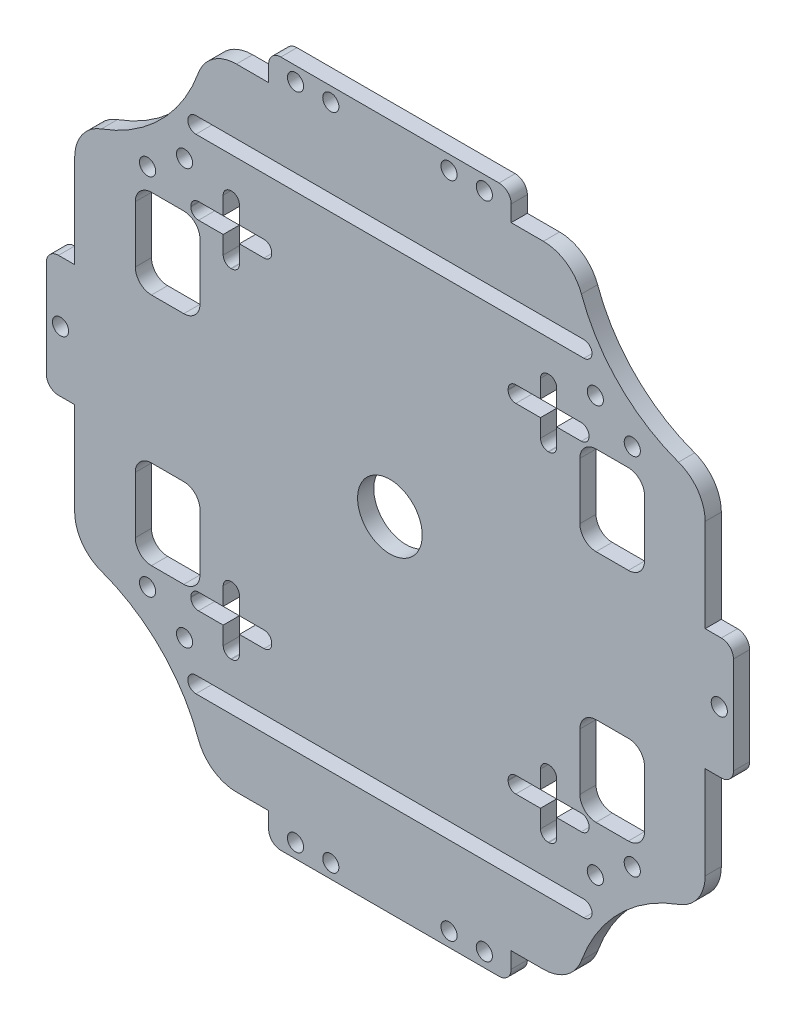
from build123d import *

# Parameters (mm, degrees)
SKETCH2_R           = 2
SKETCH2_R_2         = 8
BOSS_EXTRUDE1_DEPTH = 4


with BuildPart() as part:
    # Sketch2 → Boss-Extrude1 (new body)
    with BuildSketch(Plane.XY):
        with BuildLine():
            Line((-85, -54.5), (-85, -30.5))
            ThreePointArc((-85, -30.5), (-84.121320344, -28.378679656), (-82, -27.5))
            Line((-82, -27.5), (-78, -27.5))
            Line((-78, -27.5), (-78, -4.521271782))
            ThreePointArc((-78, -4.521271782), (-76.185352772, 1.223290865), (-71.4, 4.882982574))
            ThreePointArc((-71.4, 4.882982574), (-56.715728753, 14.215728753), (-47.382982574, 28.9))
            ThreePointArc((-47.382982574, 28.9), (-43.723290865, 33.685352772), (-37.978728218, 35.5))
            Line((-37.978728218, 35.5), (-30, 35.5))
            Line((-30, 35.5), (-30, 39.5))
            ThreePointArc((-30, 39.5), (-29.121320344, 41.621320344), (-27, 42.5))
            Line((-27, 42.5), (27, 42.5))
            ThreePointArc((27, 42.5), (29.121320344, 41.621320344), (30, 39.5))
            Line((30, 39.5), (30, 35.5))
            Line((30, 35.5), (37.978728218, 35.5))
            ThreePointArc((37.978728218, 35.5), (43.723290865, 33.685352772), (47.382982574, 28.9))
            ThreePointArc((47.382982574, 28.9), (56.715728753, 14.215728753), (71.4, 4.882982574))
            ThreePointArc((71.4, 4.882982574), (76.185352772, 1.223290865), (78, -4.521271782))
            Line((78, -4.521271782), (78, -27.5))
            Line((78, -27.5), (82, -27.5))
            ThreePointArc((82, -27.5), (84.121320344, -28.378679656), (85, -30.5))
            Line((85, -30.5), (85, -54.5))
            ThreePointArc((85, -54.5), (84.121320344, -56.621320344), (82, -57.5))
            Line((82, -57.5), (78, -57.5))
            Line((78, -57.5), (78, -80.478728218))
            ThreePointArc((78, -80.478728218), (76.185352772, -86.223290865), (71.4, -89.882982574))
            ThreePointArc((71.4, -89.882982574), (56.715728753, -99.215728753), (47.382982574, -113.9))
            ThreePointArc((47.382982574, -113.9), (43.723290865, -118.685352772), (37.978728218, -120.5))
            Line((37.978728218, -120.5), (30, -120.5))
            Line((30, -120.5), (30, -124.5))
            ThreePointArc((30, -124.5), (29.121320344, -126.621320344), (27, -127.5))
            Line((27, -127.5), (-27, -127.5))
            ThreePointArc((-27, -127.5), (-29.121320344, -126.621320344), (-30, -124.5))
            Line((-30, -124.5), (-30, -120.5))
            Line((-30, -120.5), (-37.978728218, -120.5))
            ThreePointArc((-37.978728218, -120.5), (-43.723290865, -118.685352772), (-47.382982574, -113.9))
            ThreePointArc((-47.382982574, -113.9), (-56.715728753, -99.215728753), (-71.4, -89.882982574))
            ThreePointArc((-71.4, -89.882982574), (-76.185352772, -86.223290865), (-78, -80.478728218))
            Line((-78, -80.478728218), (-78, -57.5))
            Line((-78, -57.5), (-82, -57.5))
            ThreePointArc((-82, -57.5), (-84.121320344, -56.621320344), (-85, -54.5))
        make_face()
        with Locations((81.5, -42.5)):
            Circle(SKETCH2_R, mode=Mode.SUBTRACT)
        with Locations((-81.5, -42.5)):
            Circle(SKETCH2_R, mode=Mode.SUBTRACT)
        with Locations((0, -42.5)):
            Circle(SKETCH2_R_2, mode=Mode.SUBTRACT)
        with Locations((50.822096954, 8.868152772)):
            Circle(SKETCH2_R, mode=Mode.SUBTRACT)
        with Locations((59.967308382, 2.530681695)):
            Circle(SKETCH2_R, mode=Mode.SUBTRACT)
        with Locations(Location((-50.822096954, 8.868152772, 0), (0, 0, 180))):
            Circle(SKETCH2_R, mode=Mode.SUBTRACT)
        with Locations(Location((-59.967308382, 2.530681695, 0), (0, 0, 180))):
            Circle(SKETCH2_R, mode=Mode.SUBTRACT)
        with Locations(Location((50.822096954, -93.868152772, 0), (0, 0, 180))):
            Circle(SKETCH2_R, mode=Mode.SUBTRACT)
        with Locations(Location((59.967308382, -87.530681695, 0), (0, 0, 180))):
            Circle(SKETCH2_R, mode=Mode.SUBTRACT)
        with Locations((-59.967308382, -87.530681695)):
            Circle(SKETCH2_R, mode=Mode.SUBTRACT)
        with Locations((-50.822096954, -93.868152772)):
            Circle(SKETCH2_R, mode=Mode.SUBTRACT)
        with Locations((23.359544811, 39)):
            Circle(SKETCH2_R, mode=Mode.SUBTRACT)
        with Locations((14.622540032, 39)):
            Circle(SKETCH2_R, mode=Mode.SUBTRACT)
        with Locations(Location((-14.622540032, 39, 0), (0, 0, 180))):
            Circle(SKETCH2_R, mode=Mode.SUBTRACT)
        with Locations(Location((-23.359544811, 39, 0), (0, 0, 180))):
            Circle(SKETCH2_R, mode=Mode.SUBTRACT)
        with Locations((-23.359544811, -124)):
            Circle(SKETCH2_R, mode=Mode.SUBTRACT)
        with Locations((-14.622540032, -124)):
            Circle(SKETCH2_R, mode=Mode.SUBTRACT)
        with Locations(Location((23.359544811, -124, 0), (0, 0, 180))):
            Circle(SKETCH2_R, mode=Mode.SUBTRACT)
        with Locations(Location((14.622540032, -124, 0), (0, 0, 180))):
            Circle(SKETCH2_R, mode=Mode.SUBTRACT)
        with BuildLine():
            Line((-37.25, 1.35), (-31.15, 1.35))
            ThreePointArc((-31.15, 1.35), (-29.806497116, 0.793502884), (-29.25, -0.55))
            Line((-29.25, -0.55), (-29.25, -0.75))
            ThreePointArc((-29.25, -0.75), (-29.806497116, -2.093502884), (-31.15, -2.65))
            Line((-31.15, -2.65), (-37.25, -2.65))
            Line((-37.25, -2.65), (-37.25, -7.066427382))
            ThreePointArc((-37.25, -7.066427382), (-37.806497116, -8.409930266), (-39.15, -8.966427382))
            Line((-39.15, -8.966427382), (-39.35, -8.966427382))
            ThreePointArc((-39.35, -8.966427382), (-40.693502884, -8.409930266), (-41.25, -7.066427382))
            Line((-41.25, -7.066427382), (-41.25, -2.65))
            Line((-41.25, -2.65), (-47.35, -2.65))
            ThreePointArc((-47.35, -2.65), (-48.693502884, -2.093502884), (-49.25, -0.75))
            Line((-49.25, -0.75), (-49.25, -0.55))
            ThreePointArc((-49.25, -0.55), (-48.693502884, 0.793502884), (-47.35, 1.35))
            Line((-47.35, 1.35), (-41.25, 1.35))
            Line((-41.25, 1.35), (-41.25, 5.766427382))
            ThreePointArc((-41.25, 5.766427382), (-40.693502884, 7.109930266), (-39.35, 7.666427382))
            Line((-39.35, 7.666427382), (-39.15, 7.666427382))
            ThreePointArc((-39.15, 7.666427382), (-37.806497116, 7.109930266), (-37.25, 5.766427382))
            Line((-37.25, 5.766427382), (-37.25, 1.35))
        make_face(mode=Mode.SUBTRACT)
        with BuildLine():
            Line((51, -2.5), (59, -2.5))
            ThreePointArc((59, -2.5), (61.828427125, -3.671572875), (63, -6.5))
            Line((63, -6.5), (63, -20.5))
            ThreePointArc((63, -20.5), (61.828427125, -23.328427125), (59, -24.5))
            Line((59, -24.5), (51, -24.5))
            ThreePointArc((51, -24.5), (48.171572875, -23.328427125), (47, -20.5))
            Line((47, -20.5), (47, -6.5))
            ThreePointArc((47, -6.5), (48.171572875, -3.671572875), (51, -2.5))
        make_face(mode=Mode.SUBTRACT)
        with BuildLine():
            Line((63, -78.5), (63, -64.5))
            ThreePointArc((63, -64.5), (61.828427125, -61.671572875), (59, -60.5))
            Line((59, -60.5), (51, -60.5))
            ThreePointArc((51, -60.5), (48.171572875, -61.671572875), (47, -64.5))
            Line((47, -64.5), (47, -78.5))
            ThreePointArc((47, -78.5), (48.171572875, -81.328427125), (51, -82.5))
            Line((51, -82.5), (59, -82.5))
            ThreePointArc((59, -82.5), (61.828427125, -81.328427125), (63, -78.5))
        make_face(mode=Mode.SUBTRACT)
        with BuildLine():
            Line((-51, -60.5), (-59, -60.5))
            ThreePointArc((-59, -60.5), (-61.828427125, -61.671572875), (-63, -64.5))
            Line((-63, -64.5), (-63, -78.5))
            ThreePointArc((-63, -78.5), (-61.828427125, -81.328427125), (-59, -82.5))
            Line((-59, -82.5), (-51, -82.5))
            ThreePointArc((-51, -82.5), (-48.171572875, -81.328427125), (-47, -78.5))
            Line((-47, -78.5), (-47, -64.5))
            ThreePointArc((-47, -64.5), (-48.171572875, -61.671572875), (-51, -60.5))
        make_face(mode=Mode.SUBTRACT)
        with BuildLine():
            Line((-63, -6.5), (-63, -20.5))
            ThreePointArc((-63, -20.5), (-61.828427125, -23.328427125), (-59, -24.5))
            Line((-59, -24.5), (-51, -24.5))
            ThreePointArc((-51, -24.5), (-48.171572875, -23.328427125), (-47, -20.5))
            Line((-47, -20.5), (-47, -6.5))
            ThreePointArc((-47, -6.5), (-48.171572875, -3.671572875), (-51, -2.5))
            Line((-51, -2.5), (-59, -2.5))
            ThreePointArc((-59, -2.5), (-61.828427125, -3.671572875), (-63, -6.5))
        make_face(mode=Mode.SUBTRACT)
        with BuildLine():
            Line((-48, -104.452161842), (48, -104.452161842))
            ThreePointArc((48, -104.452161842), (50, -102.452161842), (48, -100.452161842))
            Line((48, -100.452161842), (-48, -100.452161842))
            ThreePointArc((-48, -100.452161842), (-50, -102.452161842), (-48, -104.452161842))
        make_face(mode=Mode.SUBTRACT)
        with BuildLine():
            Line((-48, 19.452161842), (48, 19.452161842))
            ThreePointArc((48, 19.452161842), (50, 17.452161842), (48, 15.452161842))
            Line((48, 15.452161842), (-48, 15.452161842))
            ThreePointArc((-48, 15.452161842), (-50, 17.452161842), (-48, 19.452161842))
        make_face(mode=Mode.SUBTRACT)
        with BuildLine():
            Line((37.25, -2.65), (31.15, -2.65))
            ThreePointArc((31.15, -2.65), (29.806497116, -2.093502884), (29.25, -0.75))
            Line((29.25, -0.75), (29.25, -0.55))
            ThreePointArc((29.25, -0.55), (29.806497116, 0.793502884), (31.15, 1.35))
            Line((31.15, 1.35), (37.25, 1.35))
            Line((37.25, 1.35), (37.25, 5.766427382))
            ThreePointArc((37.25, 5.766427382), (37.806497116, 7.109930266), (39.15, 7.666427382))
            Line((39.15, 7.666427382), (39.35, 7.666427382))
            ThreePointArc((39.35, 7.666427382), (40.693502884, 7.109930266), (41.25, 5.766427382))
            Line((41.25, 5.766427382), (41.25, 1.35))
            Line((41.25, 1.35), (47.35, 1.35))
            ThreePointArc((47.35, 1.35), (48.693502884, 0.793502884), (49.25, -0.55))
            Line((49.25, -0.55), (49.25, -0.75))
            ThreePointArc((49.25, -0.75), (48.693502884, -2.093502884), (47.35, -2.65))
            Line((47.35, -2.65), (41.25, -2.65))
            Line((41.25, -2.65), (41.25, -7.066427382))
            ThreePointArc((41.25, -7.066427382), (40.693502884, -8.409930266), (39.35, -8.966427382))
            Line((39.35, -8.966427382), (39.15, -8.966427382))
            ThreePointArc((39.15, -8.966427382), (37.806497116, -8.409930266), (37.25, -7.066427382))
            Line((37.25, -7.066427382), (37.25, -2.65))
        make_face(mode=Mode.SUBTRACT)
        with BuildLine():
            Line((39.35, -92.666427382), (39.15, -92.666427382))
            ThreePointArc((39.15, -92.666427382), (37.806497116, -92.109930266), (37.25, -90.766427382))
            Line((37.25, -90.766427382), (37.25, -86.35))
            Line((37.25, -86.35), (31.15, -86.35))
            ThreePointArc((31.15, -86.35), (29.806497116, -85.793502884), (29.25, -84.45))
            Line((29.25, -84.45), (29.25, -84.25))
            ThreePointArc((29.25, -84.25), (29.806497116, -82.906497116), (31.15, -82.35))
            Line((31.15, -82.35), (37.25, -82.35))
            Line((37.25, -82.35), (37.25, -77.933572618))
            ThreePointArc((37.25, -77.933572618), (37.806497116, -76.590069734), (39.15, -76.033572618))
            Line((39.15, -76.033572618), (39.35, -76.033572618))
            ThreePointArc((39.35, -76.033572618), (40.693502884, -76.590069734), (41.25, -77.933572618))
            Line((41.25, -77.933572618), (41.25, -82.35))
            Line((41.25, -82.35), (47.35, -82.35))
            ThreePointArc((47.35, -82.35), (48.693502884, -82.906497116), (49.25, -84.25))
            Line((49.25, -84.25), (49.25, -84.45))
            ThreePointArc((49.25, -84.45), (48.693502884, -85.793502884), (47.35, -86.35))
            Line((47.35, -86.35), (41.25, -86.35))
            Line((41.25, -86.35), (41.25, -90.766427382))
            ThreePointArc((41.25, -90.766427382), (40.693502884, -92.109930266), (39.35, -92.666427382))
        make_face(mode=Mode.SUBTRACT)
        with BuildLine():
            Line((-47.35, -82.35), (-41.25, -82.35))
            Line((-41.25, -82.35), (-41.25, -77.933572618))
            ThreePointArc((-41.25, -77.933572618), (-40.693502884, -76.590069734), (-39.35, -76.033572618))
            Line((-39.35, -76.033572618), (-39.15, -76.033572618))
            ThreePointArc((-39.15, -76.033572618), (-37.806497116, -76.590069734), (-37.25, -77.933572618))
            Line((-37.25, -77.933572618), (-37.25, -82.35))
            Line((-37.25, -82.35), (-31.15, -82.35))
            ThreePointArc((-31.15, -82.35), (-29.806497116, -82.906497116), (-29.25, -84.25))
            Line((-29.25, -84.25), (-29.25, -84.45))
            ThreePointArc((-29.25, -84.45), (-29.806497116, -85.793502884), (-31.15, -86.35))
            Line((-31.15, -86.35), (-37.25, -86.35))
            Line((-37.25, -86.35), (-37.25, -90.766427382))
            ThreePointArc((-37.25, -90.766427382), (-37.806497116, -92.109930266), (-39.15, -92.666427382))
            Line((-39.15, -92.666427382), (-39.35, -92.666427382))
            ThreePointArc((-39.35, -92.666427382), (-40.693502884, -92.109930266), (-41.25, -90.766427382))
            Line((-41.25, -90.766427382), (-41.25, -86.35))
            Line((-41.25, -86.35), (-47.35, -86.35))
            ThreePointArc((-47.35, -86.35), (-48.693502884, -85.793502884), (-49.25, -84.45))
            Line((-49.25, -84.45), (-49.25, -84.25))
            ThreePointArc((-49.25, -84.25), (-48.693502884, -82.906497116), (-47.35, -82.35))
        make_face(mode=Mode.SUBTRACT)
    extrude(amount=-BOSS_EXTRUDE1_DEPTH)


solid = part.part
